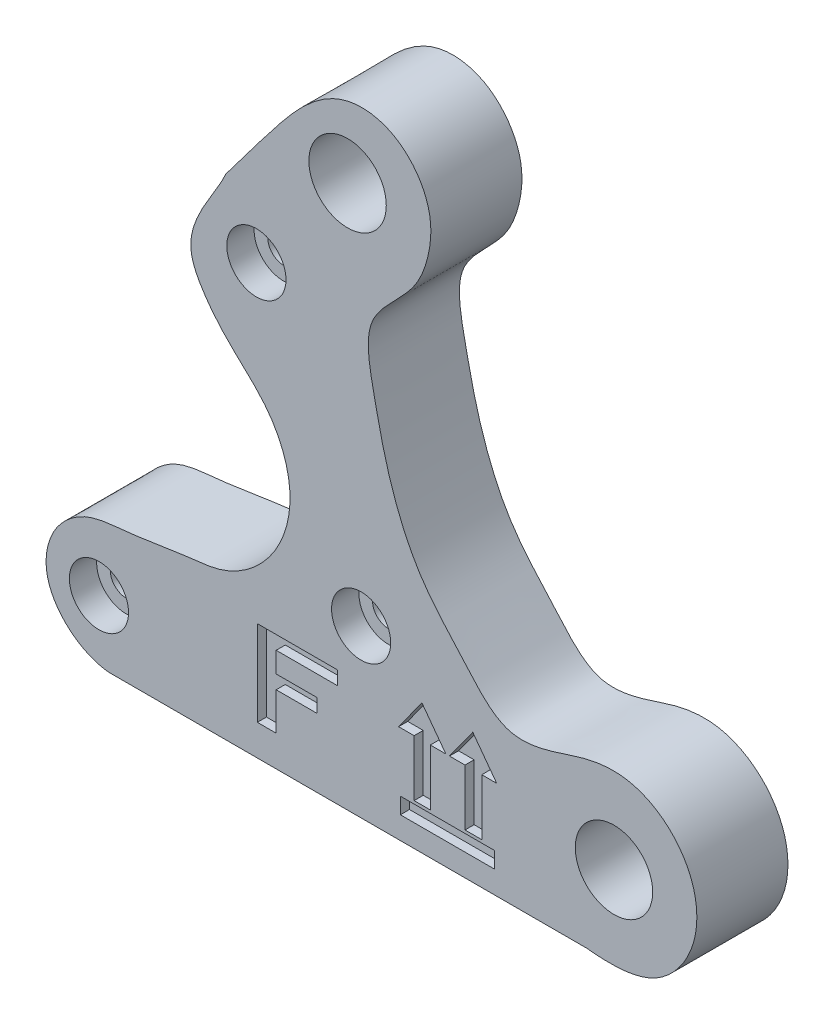
from build123d import *

# Parameters (mm, degrees)
MODEL_R            = 1.75
MODEL_R_2          = 4.25
MAIN_BODY_DEPTH    = 10
MODEL_5_W          = 10.315123612
MODEL_5_H          = 1.773937843
SYMBOLS_DEPTH      = 1
MODEL_6_R          = 3.25
MODEL_6_R_2        = 1.75
RECESS_HOLES_DEPTH = 3


with BuildPart() as part:
    # Model → Main body (new body)
    with BuildSketch(Plane.XY):
        with BuildLine():
            Line((22.086789496, -27.798245314), (-30.374196976, -27.798245314))
            add(Edge.make_bspline(
                [(-17.538442516, 26.004081512), (-18.538297116, 23.605862033), (-22.906581963, 18.754059646), (-19.989793116, 13.373218867), (-17.018344154, 9.682388722), (-12.197050491, 5.986089091), (-9.673365897, -1.214004586), (-12.056188368, -8.347550444), (-17.110409271, -12.077698709), (-21.535008402, -12.428733663), (-24.918043379, -12.97629583), (-28.588757867, -13.51709323), (-32.953232047, -13.794755273), (-36.740356431, -16.830503628), (-38.189116389, -23.616785026), (-33.487184883, -27.52082329), (-30.374196976, -27.798245314)],
                knots=[0, 0, 0, 0, 0.128042389, 0.173454018, 0.219153052, 0.309797418, 0.399283263, 0.488821231, 0.578316984, 0.618188783, 0.656226873, 0.708611844, 0.759756085, 0.819423474, 0.878794788, 1, 1, 1, 1], degree=3))
            Line((-17.538442516, 26.004081512), (-13.872151512, 30.861285205))
            add(Edge.make_bspline(
                [(-13.872151512, 30.861285205), (-11.242855817, 34.137806076), (-7.150043663, 40.520160255), (1.562226031, 39.416373843), (5.345947757, 34.558765511), (4.868367052, 29.271667753), (2.869518079, 24.35389753), (-2.770333758, 20.70690297), (-1.192098482, 12.663100042), (0.333796067, 5.604126508), (3.553312262, -1.873717532), (8.438966414, -6.929348048), (12.700727629, -12.107536515), (18.019400725, -11.221948452), (21.880721708, -9.6806106), (26.236071232, -9.168544501), (30.750432493, -10.993531334), (34.124404593, -15.30441135), (34.521705172, -21.816592139), (29.939692895, -28.16515456), (24.448344054, -28.045567403), (22.086789496, -27.798245314)],
                knots=[0, 0, 0, 0, 0.113776739, 0.147277569, 0.205992163, 0.245682974, 0.27549376, 0.337831538, 0.391118238, 0.45976214, 0.525989659, 0.587795398, 0.640878991, 0.676386947, 0.71189988, 0.747233078, 0.782556716, 0.829334419, 0.876113873, 0.937740926, 1, 1, 1, 1], degree=3))
        make_face()
        with Locations((-31.472318321, -21.04742708)):
            Circle(MODEL_R, mode=Mode.SUBTRACT)
        with Locations((25.07640309, -18.84923931)):
            Circle(MODEL_R_2, mode=Mode.SUBTRACT)
        with Locations((-4.173596907, 31.813246811)):
            Circle(MODEL_R_2, mode=Mode.SUBTRACT)
        with Locations((-14.186209652, 19.241410668)):
            Circle(MODEL_R, mode=Mode.SUBTRACT)
        with Locations((-2.684845112, -9.54606254)):
            Circle(MODEL_R, mode=Mode.SUBTRACT)
    extrude(amount=-MAIN_BODY_DEPTH)

    # Model<5> → Symbols (cut)
    with BuildSketch(Plane.XY):
        Polygon((-14.078876314, -24.403385612), (-12.013974634, -24.403385612), (-12.013974634, -20.273582251), (-7.508734034, -20.273582251), (-7.508734034, -18.771835086), (-12.013974634, -18.771835086), (-12.013974634, -16.519215234), (-5.256113735, -16.519215234), (-5.256113735, -15.017468069), (-14.078876314, -15.017468069), align=None)
        with Locations((6.781325559, -24.455008445)):
            Rectangle(MODEL_5_W, MODEL_5_H)
        Polygon((1.426659449, -17.06359838), (3.134896379, -17.06359838), (3.134896379, -23.239532051), (4.908834893, -23.239532051), (4.908834893, -17.06359838), (6.617072047, -17.06359838), (3.989014956, -13.515720904), align=None)
        Polygon((7.011280208, -17.06359838), (8.719517362, -17.06359838), (8.719517362, -23.239532051), (10.559157236, -23.239532051), (10.559157236, -17.06359838), (12.201692806, -17.06359838), (9.573635715, -13.515720904), align=None)
    extrude(amount=-SYMBOLS_DEPTH, mode=Mode.SUBTRACT)

    # Model<6> → Recess holes (cut)
    # profile 1 of 3: a face of its own
    with BuildSketch(Plane.XY):
        with Locations((-31.472318321, -21.04742708)):
            Circle(MODEL_6_R)
        with Locations((-31.472318321, -21.04742708)):
            Circle(MODEL_6_R_2, mode=Mode.SUBTRACT)
    # profile 2 of 3: a face of its own
    with BuildSketch(Plane.XY):
        with Locations((-14.186209652, 19.241410668)):
            Circle(MODEL_6_R)
        with Locations((-14.186209652, 19.241410668)):
            Circle(MODEL_6_R_2, mode=Mode.SUBTRACT)
    # profile 3 of 3: a face of its own
    with BuildSketch(Plane.XY):
        with Locations((-2.684845112, -9.54606254)):
            Circle(MODEL_6_R)
        with Locations((-2.684845112, -9.54606254)):
            Circle(MODEL_6_R_2, mode=Mode.SUBTRACT)
    extrude(amount=-RECESS_HOLES_DEPTH, mode=Mode.SUBTRACT)


solid = part.part
